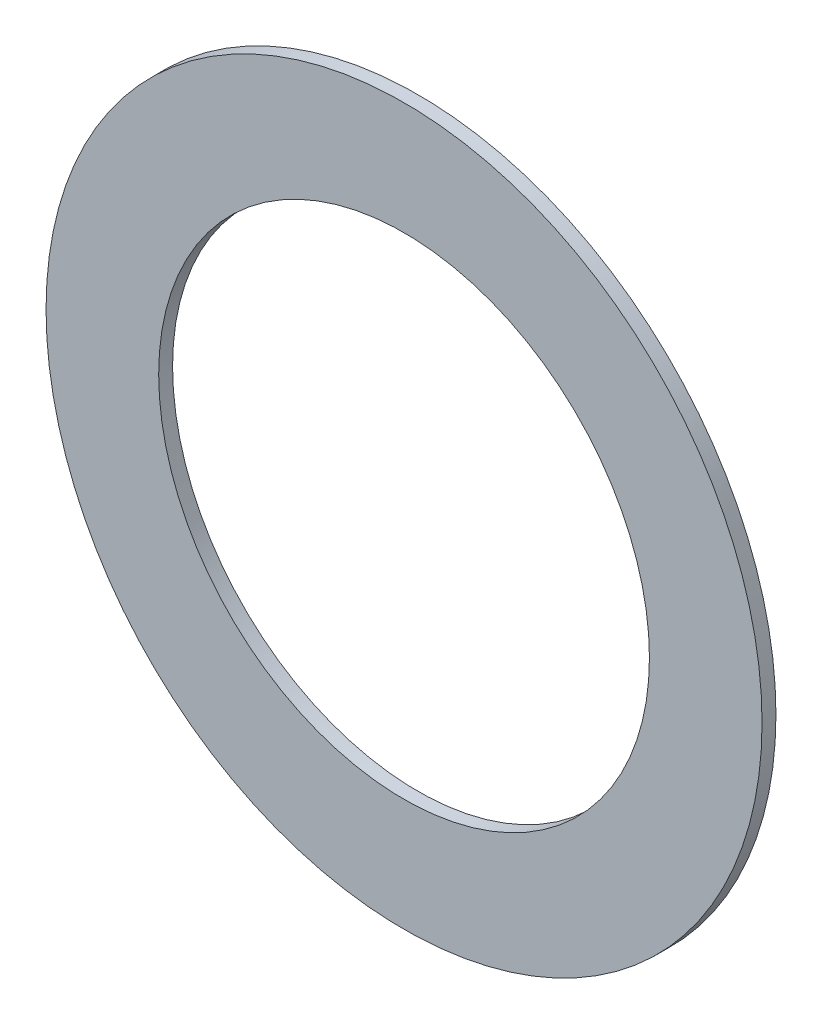
from build123d import *

# Parameters (mm, degrees)
SKIZZE1_R                       = 25.75
SKIZZE1_R_2                     = 17.65
AUFSATZ_LINEAR_AUSTRAGEN1_DEPTH = 1


with BuildPart() as part:
    # Skizze1 → Aufsatz-Linear austragen1 (new body)
    with BuildSketch(Plane.XY):
        Circle(SKIZZE1_R)
        Circle(SKIZZE1_R_2, mode=Mode.SUBTRACT)
    extrude(amount=AUFSATZ_LINEAR_AUSTRAGEN1_DEPTH)


solid = part.part
